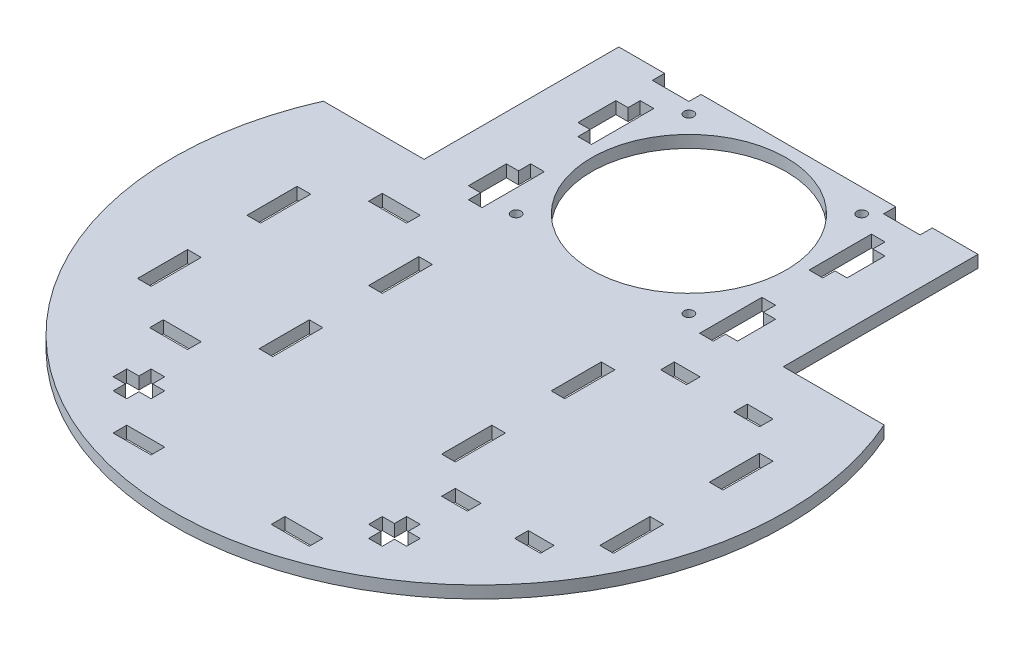
from build123d import *

# Parameters (mm, degrees)
SKETCH1_R           = 40
SKETCH1_R_2         = 2
SKETCH1_W           = 15.6
SKETCH1_H           = 5.6
SKETCH1_W_2         = 5.6
SKETCH1_H_2         = 20.6
SKETCH1_W_3         = 10.6
BOSS_EXTRUDE1_DEPTH = 5


with BuildPart() as part:
    # Sketch1 → Boss-Extrude1 (new body)
    with BuildSketch(Plane(origin=(0, 0, 0), x_dir=(-1, 0, 0), z_dir=(0, -1, 0))):
        with BuildLine():
            Line((-144.276672243, 28.966950724), (-144.276672243, -46.033049276))
            Line((-144.276672243, -46.033049276), (-185.693858461, -46.033049276))
            ThreePointArc((-185.693858461, -46.033049276), (-70.476672243, -223.033049276), (44.740513975, -46.033049276))
            Line((44.740513975, -46.033049276), (3.323327757, -46.033049276))
            Line((3.323327757, -46.033049276), (3.323327757, 28.966950724))
            Line((3.323327757, 28.966950724), (3.323327757, 33.966950724))
            Line((3.323327757, 33.966950724), (-15.476672243, 33.966950724))
            Line((-15.476672243, 33.966950724), (-15.476672243, 28.966950724))
            Line((-15.476672243, 28.966950724), (-30.476672243, 28.966950724))
            Line((-30.476672243, 28.966950724), (-30.476672243, 33.966950724))
            Line((-30.476672243, 33.966950724), (-110.476672243, 33.966950724))
            Line((-110.476672243, 33.966950724), (-110.476672243, 28.966950724))
            Line((-110.476672243, 28.966950724), (-125.476672243, 28.966950724))
            Line((-125.476672243, 28.966950724), (-125.476672243, 33.966950724))
            Line((-125.476672243, 33.966950724), (-144.276672243, 33.966950724))
            Line((-144.276672243, 33.966950724), (-144.276672243, 28.966950724))
        make_face()
        with Locations(Location((-70.476672243, -11.033049276, 0), (0, 0, 90))):
            Circle(SKETCH1_R, mode=Mode.SUBTRACT)
        with Locations(Location((-34.976672243, 24.466950724, 0), (0, 0, 90))):
            Circle(SKETCH1_R_2, mode=Mode.SUBTRACT)
        with Locations(Location((-105.976672243, 24.466950724, 0), (0, 0, 90))):
            Circle(SKETCH1_R_2, mode=Mode.SUBTRACT)
        with Locations(Location((-105.976672243, -46.533049276, 0), (0, 0, 90))):
            Circle(SKETCH1_R_2, mode=Mode.SUBTRACT)
        with Locations(Location((-34.976672243, -46.533049276, 0), (0, 0, 90))):
            Circle(SKETCH1_R_2, mode=Mode.SUBTRACT)
        Polygon((-20.176672243, -6.333049276), (-20.176672243, -1.333049276), (-15.176672243, -1.333049276), (-15.176672243, 14.266950724), (-20.176672243, 14.266950724), (-20.176672243, 19.266950724), (-25.776672243, 19.266950724), (-25.776672243, -6.333049276), align=None, mode=Mode.SUBTRACT)
        Polygon((-20.176672243, -25.733049276), (-20.176672243, -30.733049276), (-15.176672243, -30.733049276), (-15.176672243, -46.333049276), (-20.176672243, -46.333049276), (-20.176672243, -51.333049276), (-25.776672243, -51.333049276), (-25.776672243, -25.733049276), align=None, mode=Mode.SUBTRACT)
        Polygon((-120.776672243, -6.333049276), (-115.176672243, -6.333049276), (-115.176672243, 19.266950724), (-120.776672243, 19.266950724), (-120.776672243, 14.266950724), (-125.776672243, 14.266950724), (-125.776672243, -1.333049276), (-120.776672243, -1.333049276), align=None, mode=Mode.SUBTRACT)
        Polygon((-120.776672243, -25.733049276), (-115.176672243, -25.733049276), (-115.176672243, -51.333049276), (-120.776672243, -51.333049276), (-120.776672243, -46.333049276), (-125.776672243, -46.333049276), (-125.776672243, -30.733049276), (-120.776672243, -30.733049276), align=None, mode=Mode.SUBTRACT)
        with Locations((-7.976672243, -69.533049276)):
            Rectangle(SKETCH1_W, SKETCH1_H, mode=Mode.SUBTRACT)
        with Locations((17.023327757, -92.033049276)):
            Rectangle(SKETCH1_W_2, SKETCH1_H_2, mode=Mode.SUBTRACT)
        with Locations((17.023327757, -137.033049276)):
            Rectangle(SKETCH1_W_2, SKETCH1_H_2, mode=Mode.SUBTRACT)
        with Locations((-7.976672243, -159.533049276)):
            Rectangle(SKETCH1_W, SKETCH1_H, mode=Mode.SUBTRACT)
        with Locations((-32.976672243, -137.033049276)):
            Rectangle(SKETCH1_W_2, SKETCH1_H_2, mode=Mode.SUBTRACT)
        with Locations((-32.976672243, -92.033049276)):
            Rectangle(SKETCH1_W_2, SKETCH1_H_2, mode=Mode.SUBTRACT)
        with Locations((-37.976672243, -204.533049276)):
            Rectangle(SKETCH1_W, SKETCH1_H, mode=Mode.SUBTRACT)
        Polygon((-20.776672243, -176.733049276), (-20.776672243, -181.733049276), (-25.776672243, -181.733049276), (-25.776672243, -187.333049276), (-20.776672243, -187.333049276), (-20.776672243, -192.333049276), (-15.176672243, -192.333049276), (-15.176672243, -187.333049276), (-10.176672243, -187.333049276), (-10.176672243, -181.733049276), (-15.176672243, -181.733049276), (-15.176672243, -176.733049276), align=None, mode=Mode.SUBTRACT)
        with Locations((-102.976672243, -204.533049276)):
            Rectangle(SKETCH1_W, SKETCH1_H, mode=Mode.SUBTRACT)
        Polygon((-120.176672243, -176.733049276), (-125.776672243, -176.733049276), (-125.776672243, -181.733049276), (-130.776672243, -181.733049276), (-130.776672243, -187.333049276), (-125.776672243, -187.333049276), (-125.776672243, -192.333049276), (-120.176672243, -192.333049276), (-120.176672243, -187.333049276), (-115.176672243, -187.333049276), (-115.176672243, -181.733049276), (-120.176672243, -181.733049276), align=None, mode=Mode.SUBTRACT)
        with Locations((-125.476672243, -159.533049276)):
            Rectangle(SKETCH1_W_3, SKETCH1_H, mode=Mode.SUBTRACT)
        with Locations((-155.476672243, -159.533049276)):
            Rectangle(SKETCH1_W_3, SKETCH1_H, mode=Mode.SUBTRACT)
        with Locations((-107.976672243, -137.033049276)):
            Rectangle(SKETCH1_W_2, SKETCH1_H_2, mode=Mode.SUBTRACT)
        with Locations((-172.976672243, -137.033049276)):
            Rectangle(SKETCH1_W_2, SKETCH1_H_2, mode=Mode.SUBTRACT)
        with Locations((-172.976672243, -92.033049276)):
            Rectangle(SKETCH1_W_2, SKETCH1_H_2, mode=Mode.SUBTRACT)
        with Locations((-107.976672243, -92.033049276)):
            Rectangle(SKETCH1_W_2, SKETCH1_H_2, mode=Mode.SUBTRACT)
        with Locations((-125.476672243, -69.533049276)):
            Rectangle(SKETCH1_W_3, SKETCH1_H, mode=Mode.SUBTRACT)
        with Locations((-155.476672243, -69.533049276)):
            Rectangle(SKETCH1_W_3, SKETCH1_H, mode=Mode.SUBTRACT)
    extrude(amount=BOSS_EXTRUDE1_DEPTH)


solid = part.part
